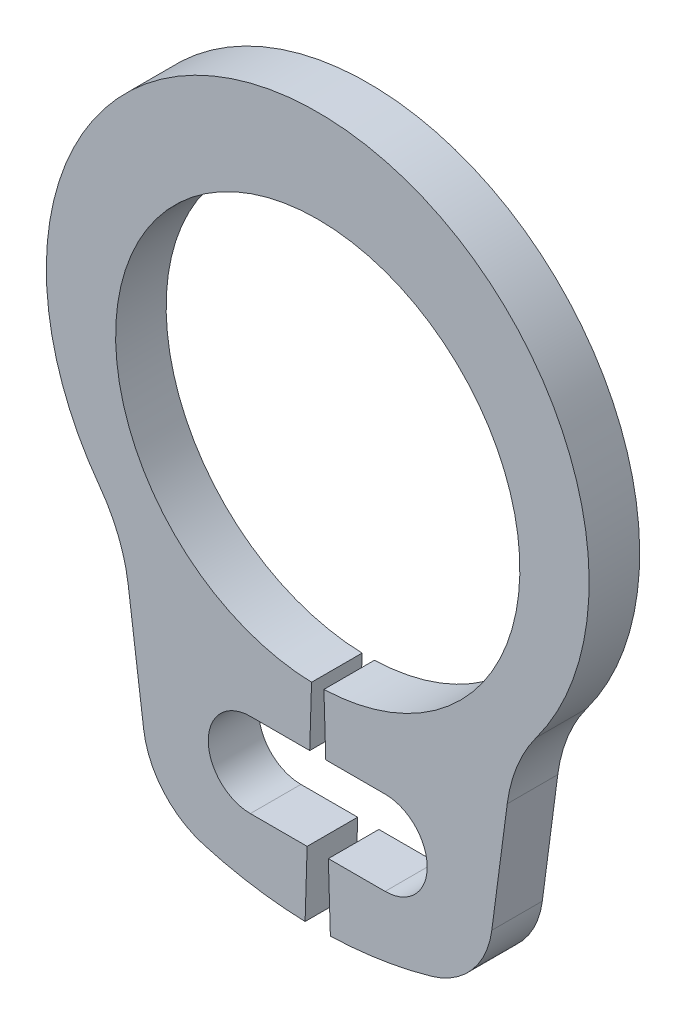
from build123d import *

# Parameters (mm, degrees)
BODYSKE_R   = 0.5
BODY_DEPTH  = 0.6
NOTSKE_W    = 1.6
NOTSKE_H    = 1
NOTCH_DEPTH = 6.893443333


with BuildPart() as part:
    # BodySke → Body (new body)
    with BuildSketch(Plane.XY):
        with BuildLine():
            Line((0.073469388, -2.398875205), (0.15, -4.897703543))
            ThreePointArc((0.15, -4.897703543), (0.756364658, -4.841271786), (1.351046377, -4.710060901))
            ThreePointArc((1.351046377, -4.710060901), (1.832916944, -4.40154969), (2.066767488, -3.879350174))
            Line((2.066767488, -3.879350174), (2.250111825, -2.486711672))
            ThreePointArc((2.250111825, -2.486711672), (2.367679184, -2.039525525), (2.593186415, -1.635862271))
            ThreePointArc((2.593186415, -1.635862271), (0, 3.5), (-2.593186415, -1.635862271))
            ThreePointArc((-2.593186415, -1.635862271), (-2.367679184, -2.039525525), (-2.250111825, -2.486711672))
            Line((-2.250111825, -2.486711672), (-2.066767488, -3.879350174))
            ThreePointArc((-2.066767488, -3.879350174), (-1.832916944, -4.40154969), (-1.351046377, -4.710060901))
            ThreePointArc((-1.351046377, -4.710060901), (-0.756364658, -4.841271786), (-0.15, -4.897703543))
            Line((-0.15, -4.897703543), (-0.073469388, -2.398875205))
            ThreePointArc((-0.073469388, -2.398875205), (0, 2.4), (0.073469388, -2.398875205))
        make_face()
        with Locations((0.8, -3.612478374)):
            Circle(BODYSKE_R, mode=Mode.SUBTRACT)
        with Locations((-0.8, -3.612478374)):
            Circle(BODYSKE_R, mode=Mode.SUBTRACT)
    extrude(amount=-BODY_DEPTH)

    # NotSke → Notch (cut, through all)
    with BuildSketch(Plane.XY):
        with Locations((0, -3.612478374)):
            Rectangle(NOTSKE_W, NOTSKE_H)
    extrude(amount=-NOTCH_DEPTH, mode=Mode.SUBTRACT)


solid = part.part
